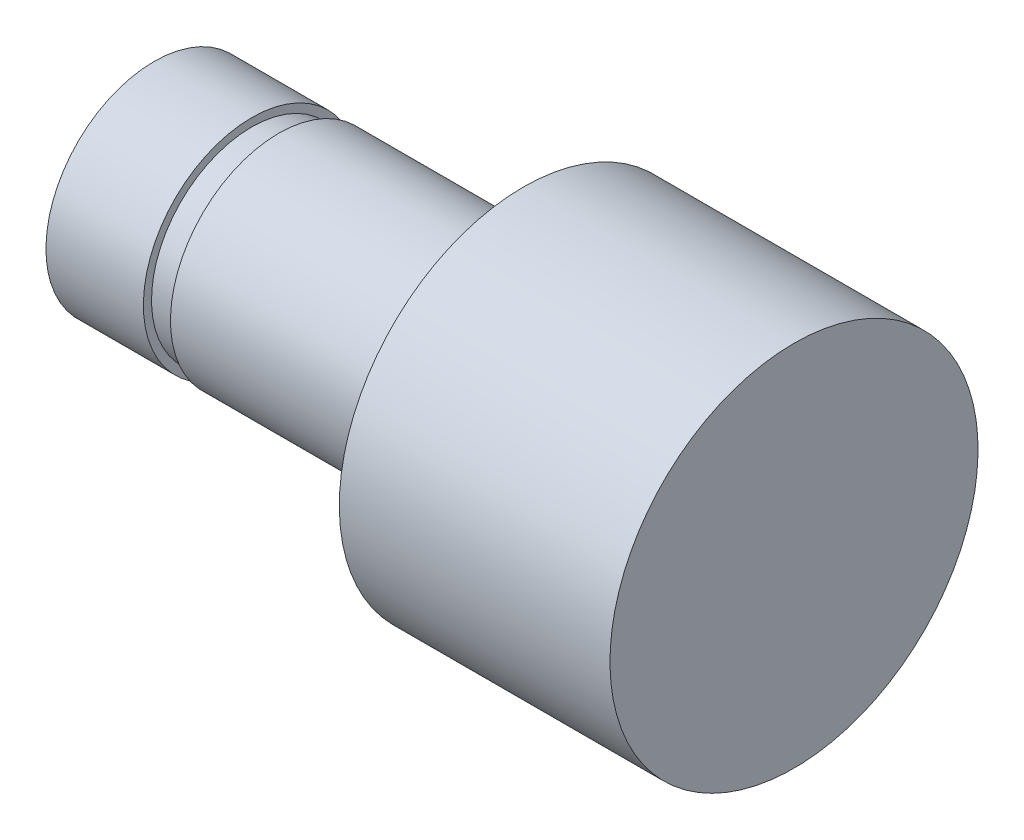
from build123d import *


with BuildPart() as part:
    # Skizze2 → Rotation1 (revolve)
    with BuildSketch(Plane.XY):
        Polygon((2.656451613, 0), (-9.163548387, 0), (-9.163548387, 2), (-7.363548387, 2), (-7.363548387, 1.85), (-6.863548387, 1.85), (-6.863548387, 2), (-2.343548387, 2), (-2.343548387, 3.4), (2.656451613, 3.4), align=None)
    revolve(axis=Axis((2.656451613, 0, 0), (-1, 0, 0)))


solid = part.part
